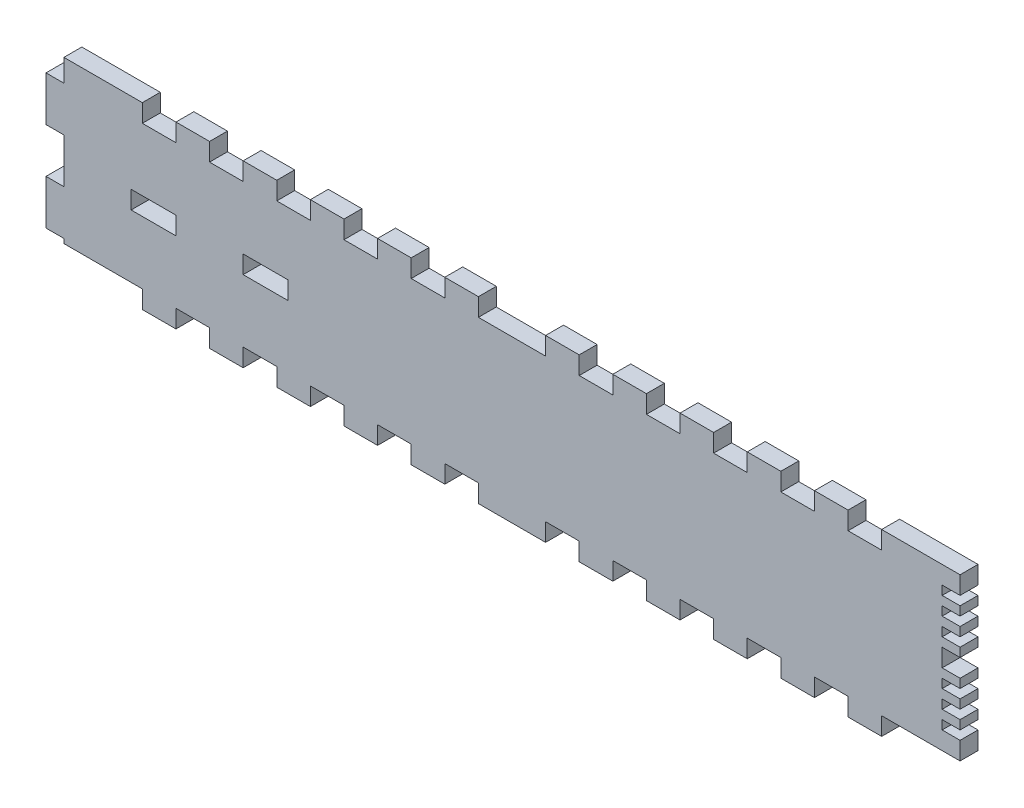
from build123d import *

# Parameters (mm, degrees)
ESQUISSE1_W             = 400
ESQUISSE1_H             = 80
BOSS_EXTRU_1_DEPTH      = 8
ESQUISSE2_W             = 8
ESQUISSE2_H             = 20
BOSS_EXTRU_2_DEPTH      = 8
ESQUISSE4_W             = 15
ESQUISSE4_H             = 8
ENL_V_MAT_EXTRU_1_DEPTH = 212.962260792
ESQUISSE5_W             = 15
ESQUISSE5_H             = 8
ESQUISSE5_W_2           = 35
ENL_V_MAT_EXTRU_2_DEPTH = 212.962260792
ESQUISSE6_W             = 20
ESQUISSE6_H             = 8
ENL_V_MAT_EXTRU_3_DEPTH = 212.962260792
ESQUISSE8_W             = 8
ESQUISSE8_H             = 4
ENL_V_MAT_EXTRU_5_DEPTH = 212.962260792


with BuildPart() as part:
    # Esquisse1 → Boss.-Extru.1 (new body)
    with BuildSketch(Plane.XY):
        Rectangle(ESQUISSE1_W, ESQUISSE1_H)
    extrude(amount=BOSS_EXTRU_1_DEPTH)

    # Esquisse2 → Boss.-Extru.2 (add)
    with BuildSketch(Plane.XY):
        with Locations((-204, 20)):
            Rectangle(ESQUISSE2_W, ESQUISSE2_H)
        with Locations((-204, -20)):
            Rectangle(ESQUISSE2_W, ESQUISSE2_H)
    extrude(amount=BOSS_EXTRU_2_DEPTH)

    # Esquisse4 → Enlèv. mat.-Extru.1 (cut, through all)
    with BuildSketch(Plane.XY):
        Polygon((0, 40), (-15, 40), (-15, 32), (0, 32), (15, 32), (15, 40), align=None)
        with Locations((-37.5, 36)):
            Rectangle(ESQUISSE4_W, ESQUISSE4_H)
        with Locations((-67.5, 36)):
            Rectangle(ESQUISSE4_W, ESQUISSE4_H)
        with Locations((-97.5, 36)):
            Rectangle(ESQUISSE4_W, ESQUISSE4_H)
        with Locations((-127.5, 36)):
            Rectangle(ESQUISSE4_W, ESQUISSE4_H)
        with Locations((-157.5, 36)):
            Rectangle(ESQUISSE4_W, ESQUISSE4_H)
        with Locations((37.5, 36)):
            Rectangle(ESQUISSE4_W, ESQUISSE4_H)
        with Locations((67.5, 36)):
            Rectangle(ESQUISSE4_W, ESQUISSE4_H)
        with Locations((97.5, 36)):
            Rectangle(ESQUISSE4_W, ESQUISSE4_H)
        with Locations((127.5, 36)):
            Rectangle(ESQUISSE4_W, ESQUISSE4_H)
        with Locations((157.5, 36)):
            Rectangle(ESQUISSE4_W, ESQUISSE4_H)
    extrude(amount=ENL_V_MAT_EXTRU_1_DEPTH, mode=Mode.SUBTRACT)

    # Esquisse5 → Enlèv. mat.-Extru.2 (cut, through all)
    with BuildSketch(Plane.XY):
        with Locations((-22.5, -36)):
            Rectangle(ESQUISSE5_W, ESQUISSE5_H)
        with Locations((-52.5, -36)):
            Rectangle(ESQUISSE5_W, ESQUISSE5_H)
        with Locations((-82.5, -36)):
            Rectangle(ESQUISSE5_W, ESQUISSE5_H)
        with Locations((-112.5, -36)):
            Rectangle(ESQUISSE5_W, ESQUISSE5_H)
        with Locations((-142.5, -36)):
            Rectangle(ESQUISSE5_W, ESQUISSE5_H)
        with Locations((-182.5, -36)):
            Rectangle(ESQUISSE5_W_2, ESQUISSE5_H)
        with Locations((22.5, -36)):
            Rectangle(ESQUISSE5_W, ESQUISSE5_H)
        with Locations((52.5, -36)):
            Rectangle(ESQUISSE5_W, ESQUISSE5_H)
        with Locations((82.5, -36)):
            Rectangle(ESQUISSE5_W, ESQUISSE5_H)
        with Locations((112.5, -36)):
            Rectangle(ESQUISSE5_W, ESQUISSE5_H)
        with Locations((142.5, -36)):
            Rectangle(ESQUISSE5_W, ESQUISSE5_H)
        with Locations((182.5, -36)):
            Rectangle(ESQUISSE5_W_2, ESQUISSE5_H)
    extrude(amount=ENL_V_MAT_EXTRU_2_DEPTH, mode=Mode.SUBTRACT)

    # Esquisse6 → Enlèv. mat.-Extru.3 (cut, through all)
    with BuildSketch(Plane.XY):
        with Locations((-160, 0)):
            Rectangle(ESQUISSE6_W, ESQUISSE6_H)
        with Locations((-110, 0)):
            Rectangle(ESQUISSE6_W, ESQUISSE6_H)
    extrude(amount=ENL_V_MAT_EXTRU_3_DEPTH, mode=Mode.SUBTRACT)

    # Esquisse8 → Enlèv. mat.-Extru.5 (cut, through all)
    with BuildSketch(Plane.XY):
        Polygon((200, 4), (200, 8), (192, 8), (192, 4), (192, 0), (200, 0), align=None)
        with Locations((196, 14)):
            Rectangle(ESQUISSE8_W, ESQUISSE8_H)
        with Locations((196, 22)):
            Rectangle(ESQUISSE8_W, ESQUISSE8_H)
        with Locations((196, 30)):
            Rectangle(ESQUISSE8_W, ESQUISSE8_H)
        with Locations((196, -6)):
            Rectangle(ESQUISSE8_W, ESQUISSE8_H)
        with Locations((196, -14)):
            Rectangle(ESQUISSE8_W, ESQUISSE8_H)
        with Locations((196, -22)):
            Rectangle(ESQUISSE8_W, ESQUISSE8_H)
    extrude(amount=ENL_V_MAT_EXTRU_5_DEPTH, mode=Mode.SUBTRACT)


solid = part.part
